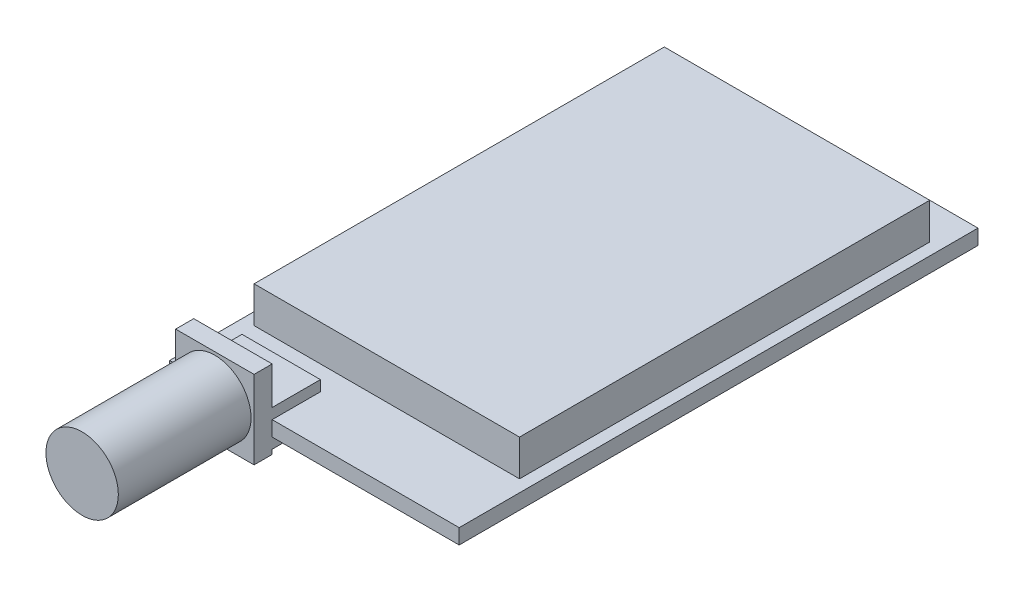
from build123d import *

# Parameters (mm, degrees)
SKETCH1_W                  = 24
SKETCH1_H                  = 43
PCB_DEPTH                  = 1.25
SKETCH2_W                  = 22
SKETCH2_H                  = 34
RF_CASING_DEPTH            = 3
SKETCH3_W                  = 6.5
SKETCH3_H                  = 6.5
RF_CONNECTOR_BACK_DEPTH    = 1.5
SKETCH4_R                  = 3
RF_CONNECTOR_THREADS_DEPTH = 11
SKETCH5_W                  = 6.5
SKETCH5_H                  = 3
RF_CONNECTOR_PINS_DEPTH    = 4


with BuildPart() as part:
    # Sketch1 → PCB (new body)
    with BuildSketch(Plane(origin=(0, 0, 0), x_dir=(1, 0, 0), z_dir=(0, 1, 0))):
        Rectangle(SKETCH1_W, SKETCH1_H)
    extrude(amount=PCB_DEPTH)

    # Sketch2 → RF Casing (add)
    with BuildSketch(Plane(origin=(0, 1.25, 0), x_dir=(1, 0, 0), z_dir=(0, 1, 0))):
        with Locations((0, 1.5)):
            Rectangle(SKETCH2_W, SKETCH2_H)
    extrude(amount=RF_CASING_DEPTH)

    # Sketch3 → RF Connector Back (add)
    with BuildSketch(Plane.XY.offset(21.5)):
        with Locations((-6.75, 2)):
            Rectangle(SKETCH3_W, SKETCH3_H)
    extrude(amount=RF_CONNECTOR_BACK_DEPTH)

    # Sketch4 → RF Connector Threads (add)
    with BuildSketch(Plane.XY.offset(23)):
        with Locations((-6.75, 2)):
            Circle(SKETCH4_R)
    extrude(amount=RF_CONNECTOR_THREADS_DEPTH)

    # Sketch5 → RF Connector Pins (add)
    with BuildSketch(Plane(origin=(0, 0, 21.5), x_dir=(-1, 0, 0), z_dir=(0, 0, -1))):
        with Locations((6.75, 0.625)):
            Rectangle(SKETCH5_W, SKETCH5_H)
    extrude(amount=RF_CONNECTOR_PINS_DEPTH)


solid = part.part
